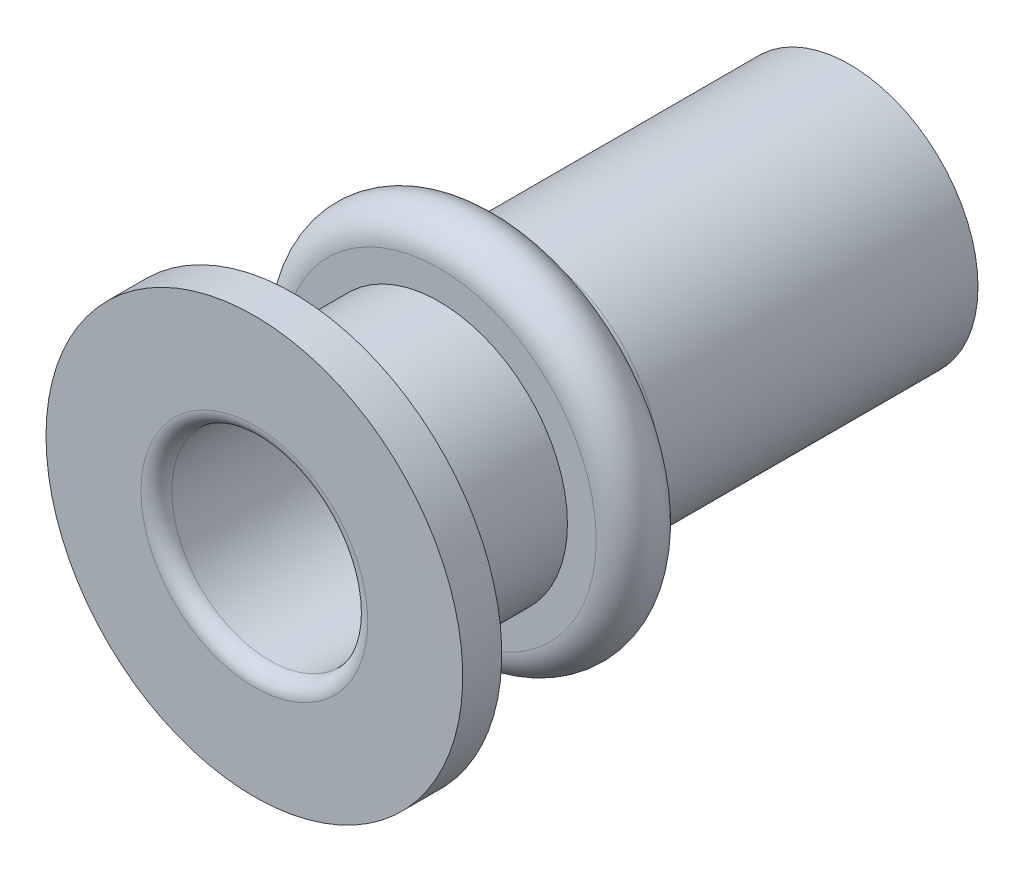
from build123d import *


with BuildPart() as part:
    # Sketch1 → Revolve1 (revolve)
    with BuildSketch(Plane(origin=(0, 0, 0), x_dir=(0, 0, -1), z_dir=(1, 0, 0)), mode=Mode.PRIVATE) as revolve1_sk:
        with BuildLine():
            Line((0, 2.8067), (0, 5.1562))
            Line((0, 5.1562), (0.9652, 5.1562))
            Line((0.9652, 5.1562), (0.9652, 3.175))
            Line((0.9652, 3.175), (4.572, 3.175))
            Line((4.572, 3.175), (4.572, 3.8862))
            ThreePointArc((4.572, 3.8862), (5.334, 4.6482), (6.096, 3.8862))
            Line((6.096, 3.8862), (6.096, 3.937))
            ThreePointArc((6.096, 3.937), (6.319184633, 3.398184633), (6.858, 3.175))
            Line((6.858, 3.175), (14.732, 3.175))
            Line((14.732, 3.175), (14.732, 2.4257))
            Line((14.732, 2.4257), (14.497364851, 2.0193))
            Line((14.497364851, 2.0193), (7.092635149, 2.0193))
            Line((7.092635149, 2.0193), (6.858, 2.4257))
            Line((6.858, 2.4257), (0.381, 2.4257))
            ThreePointArc((0.381, 2.4257), (0.111592316, 2.537292316), (0, 2.8067))
        make_face()
    revolve(revolve1_sk.sketch.rotate(Axis((0, 0, 2.825013871), (0, 0, 1)), 90), axis=Axis((0, 0, 2.825013871), (0, 0, 1)))


solid = part.part
